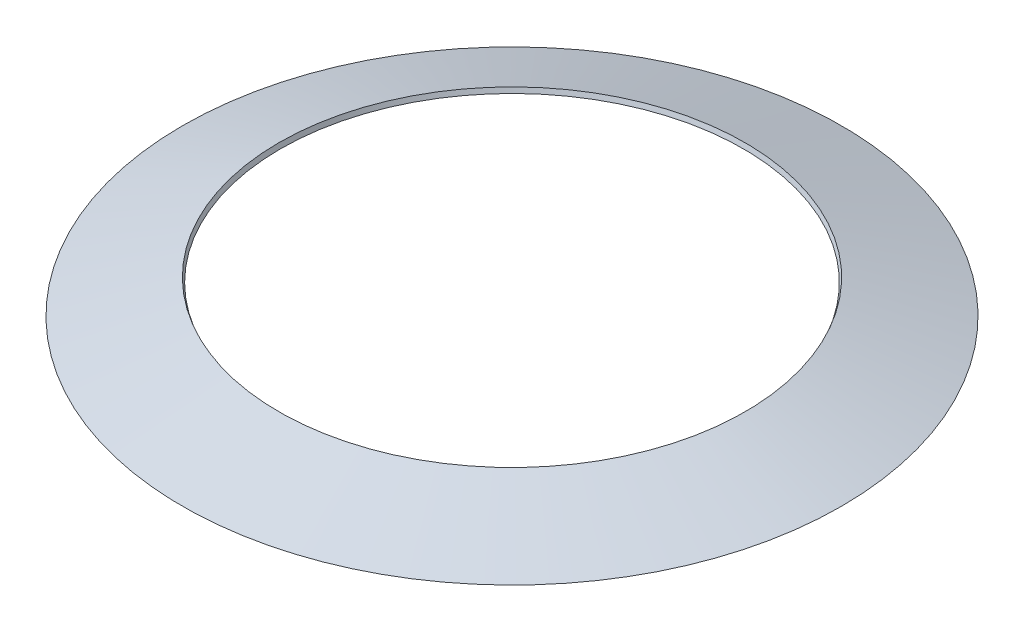
from build123d import *

# Parameters (mm, degrees)
ENL_V_MAT_EXTRU_1_DEPTH      = 100.300632559
ENL_V_MAT_EXTRU_1_DEPTH_BACK = 100.300632559
ESQUISSE2_W                  = 136
ESQUISSE2_H                  = 0.944376371


with BuildPart() as part:
    # Esquisse1 → Base-Révol.-Mince (revolve)
    with BuildSketch(Plane.XY, mode=Mode.PRIVATE) as base_r_vol_mince_sk:
        Polygon((68, 17.819894607), (48.096366151, 24.751073243), (47.767499504, 23.806696872), (67.671133353, 16.875518236), align=None)
    revolve(base_r_vol_mince_sk.sketch.rotate(Axis((0, -60, 0), (0, -1, 0)), 180), axis=Axis((0, -60, 0), (0, -1, 0)))

    # Esquisse2 → Enlèv. mat.-Extru.1 (cut, two sides: drawn at the far end of the back side and taken through both)
    with BuildSketch(Plane.XY.offset(-ENL_V_MAT_EXTRU_1_DEPTH_BACK)):
        with Locations((0, 17.347706421)):
            Rectangle(ESQUISSE2_W, ESQUISSE2_H)
    extrude(amount=ENL_V_MAT_EXTRU_1_DEPTH + ENL_V_MAT_EXTRU_1_DEPTH_BACK, mode=Mode.SUBTRACT)


solid = part.part
